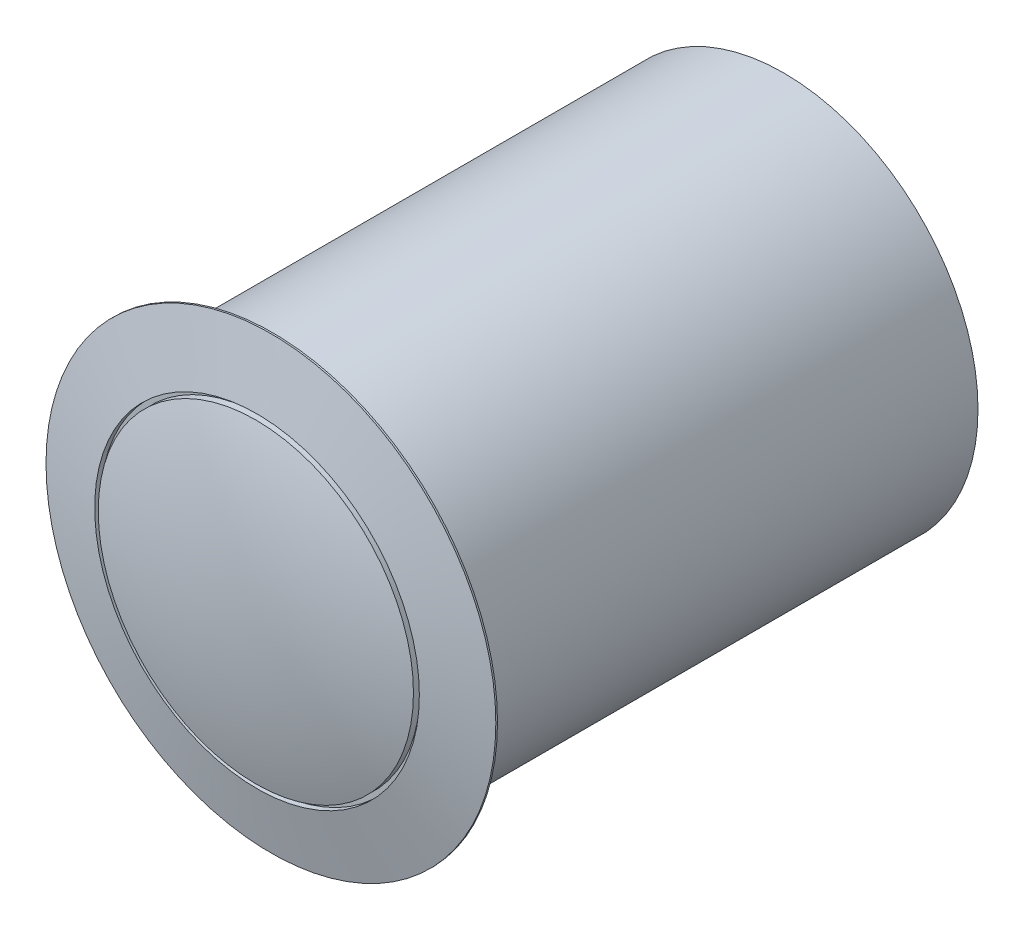
from build123d import *


with BuildPart() as part:
    # Skica1 → Rotovat1 (revolve)
    with BuildSketch(Plane(origin=(0, 0, 0), x_dir=(1, 0, 0), z_dir=(0, 1, 0))):
        with BuildLine():
            Line((9.5, 0), (9.5, 25))
            Line((9.5, 25), (0, 25))
            Line((0, 25), (0, -1.929477619))
            ThreePointArc((0, -1.929477619), (3.894000592, -1.650357757), (7.70838162, -0.818705261))
            Line((7.70838162, -0.818705261), (7.70838162, -0.488101593))
            Line((7.70838162, -0.488101593), (7.939207246, -0.488101593))
            Line((7.939207246, -0.488101593), (7.939207246, -0.761243378))
            Line((7.939207246, -0.761243378), (11, -0.082108279))
            Line((11, -0.082108279), (11, 0))
            Line((11, 0), (9.5, 0))
        make_face()
    revolve(axis=Axis((0, 0, 3.381080674), (0, 0, -1)))


solid = part.part
